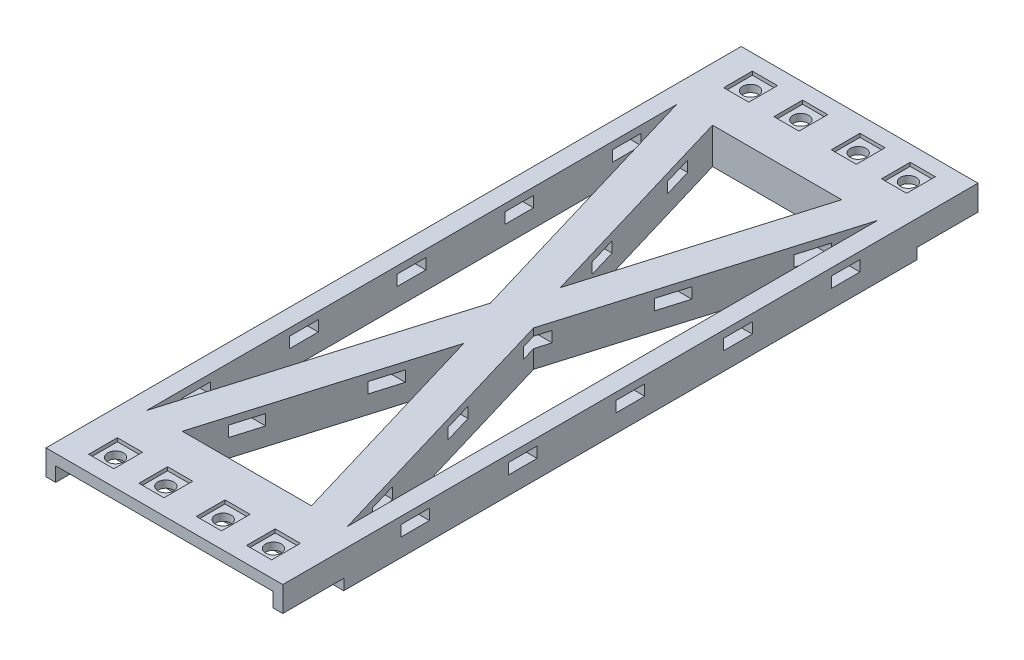
from build123d import *

# Parameters (mm, degrees)
SKETCH1_W           = 66
SKETCH1_H           = 193.8
BOSS_EXTRUDE1_DEPTH = 10
SKETCH2_W           = 66
SKETCH2_H           = 17
CUT_EXTRUDE1_DEPTH  = 3
SKETCH3_W           = 66
SKETCH3_H           = 17
CUT_EXTRUDE2_DEPTH  = 3
SKETCH4_W           = 60.6
SKETCH4_H           = 4
CUT_EXTRUDE3_DEPTH  = 17
SKETCH5_W           = 60.6
SKETCH5_H           = 4
CUT_EXTRUDE4_DEPTH  = 17
SKETCH6_R           = 2.2
CUT_EXTRUDE5_DEPTH  = 10
SKETCH7_W           = 7
SKETCH7_H           = 8
CUT_EXTRUDE6_DEPTH  = 1
CUT_EXTRUDE7_DEPTH  = 271.07407236
SKETCH9_W           = 8
SKETCH9_H           = 3
CUT_EXTRUDE8_DEPTH  = 127.422870419


with BuildPart() as part:
    # Sketch1 → Boss-Extrude1 (new body)
    with BuildSketch(Plane(origin=(0, 0, 0), x_dir=(1, 0, 0), z_dir=(0, 1, 0))):
        with Locations((214.615149771, -10.462666532)):
            Rectangle(SKETCH1_W, SKETCH1_H)
    extrude(amount=BOSS_EXTRUDE1_DEPTH)

    # Sketch2 → Cut-Extrude1 (cut)
    with BuildSketch(Plane.XZ):
        with Locations((214.615149771, -77.937333468)):
            Rectangle(SKETCH2_W, SKETCH2_H)
    extrude(amount=-CUT_EXTRUDE1_DEPTH, mode=Mode.SUBTRACT)

    # Sketch3 → Cut-Extrude2 (cut)
    with BuildSketch(Plane.XZ):
        with Locations((214.615149771, 98.862666532)):
            Rectangle(SKETCH3_W, SKETCH3_H)
    extrude(amount=-CUT_EXTRUDE2_DEPTH, mode=Mode.SUBTRACT)

    # Sketch4 → Cut-Extrude3 (cut)
    with BuildSketch(Plane(origin=(0, 0, -86.437333468), x_dir=(-1, 0, 0), z_dir=(0, 0, -1))):
        with Locations((-214.615149771, 5)):
            Rectangle(SKETCH4_W, SKETCH4_H)
    extrude(amount=-CUT_EXTRUDE3_DEPTH, mode=Mode.SUBTRACT)

    # Sketch5 → Cut-Extrude4 (cut)
    with BuildSketch(Plane.XY.offset(107.362666532)):
        with Locations((214.615149771, 5)):
            Rectangle(SKETCH5_W, SKETCH5_H)
    extrude(amount=-CUT_EXTRUDE4_DEPTH, mode=Mode.SUBTRACT)

    # Sketch6 → Cut-Extrude5 (cut)
    with BuildSketch(Plane.XZ):
        with Locations(Location((236.615149771, 98.962666532, 0), (0, 0, 90))):
            Circle(SKETCH6_R)
        with Locations(Location((222.615149771, 98.962666532, 0), (0, 0, 90))):
            Circle(SKETCH6_R)
        with Locations(Location((206.615149771, 98.962666532, 0), (0, 0, 90))):
            Circle(SKETCH6_R)
        with Locations(Location((192.615149771, 98.962666532, 0), (0, 0, 90))):
            Circle(SKETCH6_R)
        with Locations(Location((236.615149771, -78.037333468, 0), (0, 0, 90))):
            Circle(SKETCH6_R)
        with Locations(Location((222.615149771, -78.037333468, 0), (0, 0, 90))):
            Circle(SKETCH6_R)
        with Locations(Location((206.615149771, -78.037333468, 0), (0, 0, 90))):
            Circle(SKETCH6_R)
        with Locations(Location((192.615149771, -78.037333468, 0), (0, 0, 90))):
            Circle(SKETCH6_R)
    extrude(amount=-CUT_EXTRUDE5_DEPTH, mode=Mode.SUBTRACT)

    # Sketch7 → Cut-Extrude6 (cut)
    with BuildSketch(Plane(origin=(0, 10, 0), x_dir=(1, 0, 0), z_dir=(0, 1, 0))):
        with Locations((192.615149771, 78.037333468)):
            Rectangle(SKETCH7_W, SKETCH7_H)
        with Locations((206.615149771, 78.037333468)):
            Rectangle(SKETCH7_W, SKETCH7_H)
        with Locations((222.615149771, 78.037333468)):
            Rectangle(SKETCH7_W, SKETCH7_H)
        with Locations((236.615149771, 78.037333468)):
            Rectangle(SKETCH7_W, SKETCH7_H)
        with Locations((236.615149771, -98.962666532)):
            Rectangle(SKETCH7_W, SKETCH7_H)
        with Locations((222.615149771, -98.962666532)):
            Rectangle(SKETCH7_W, SKETCH7_H)
        with Locations((206.615149771, -98.962666532)):
            Rectangle(SKETCH7_W, SKETCH7_H)
        with Locations((192.615149771, -98.962666532)):
            Rectangle(SKETCH7_W, SKETCH7_H)
    extrude(amount=-CUT_EXTRUDE6_DEPTH, mode=Mode.SUBTRACT)

    # Sketch8 → Cut-Extrude7 (cut, through all)
    with BuildSketch(Plane(origin=(0, 10, 0), x_dir=(1, 0, 0), z_dir=(0, 1, 0))):
        Polygon((186.615149771, 63.437333468), (186.615149771, -84.362666532), (208.615149771, -10.462666532), align=None)
        Polygon((196.615149771, 63.437333468), (214.615149771, 2.973697104), (232.615149771, 63.437333468), align=None)
        Polygon((214.615149771, -23.899030169), (196.615149771, -84.362666532), (232.615149771, -84.362666532), align=None)
        Polygon((242.615149771, 63.437333468), (242.615149771, -84.362666532), (220.615149771, -10.462666532), align=None)
    extrude(amount=-CUT_EXTRUDE7_DEPTH, mode=Mode.SUBTRACT)

    # Sketch9 → Cut-Extrude8 (cut, through all)
    with BuildSketch(Plane(origin=(247.615149771, 0, 0), x_dir=(0, 0, -1), z_dir=(1, 0, 0))):
        with Locations((-70.462666532, 6.5)):
            Rectangle(SKETCH9_W, SKETCH9_H)
        with Locations((-40.462666532, 6.5)):
            Rectangle(SKETCH9_W, SKETCH9_H)
        with Locations((-10.462666532, 6.5)):
            Rectangle(SKETCH9_W, SKETCH9_H)
        with Locations((19.537333468, 6.5)):
            Rectangle(SKETCH9_W, SKETCH9_H)
        with Locations((49.537333468, 6.5)):
            Rectangle(SKETCH9_W, SKETCH9_H)
    extrude(amount=-CUT_EXTRUDE8_DEPTH, mode=Mode.SUBTRACT)


solid = part.part
